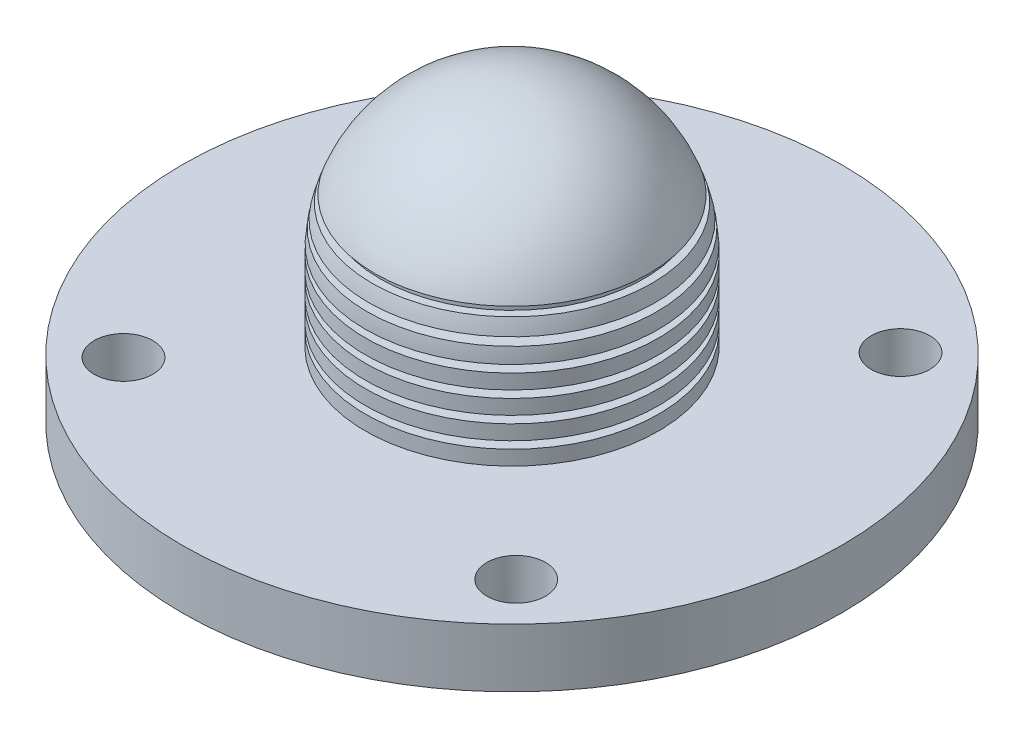
from build123d import *

# Parameters (mm, degrees)
SKETCH_1_R          = 22.5
EXTRUDE_1_DEPTH     = 4
SKETCH_2_R          = 10
EXTRUDE_2_DEPTH     = 16
FILLET_1_R          = 10
SKETCH_3_R          = 2
CUT_EXTRUDE_1_DEPTH = 10
SKETCH_4_W          = 1
SKETCH_4_H          = 0.5


with BuildPart() as part:
    # 草图1 → 凸台-拉伸1 (new body)
    with BuildSketch(Plane(origin=(0, 0, 0), x_dir=(1, 0, 0), z_dir=(0, 1, 0))):
        Circle(SKETCH_1_R)
    extrude(amount=EXTRUDE_1_DEPTH)

    # 草图2 → 凸台-拉伸2 (add)
    with BuildSketch(Plane(origin=(0, 4, 0), x_dir=(1, 0, 0), z_dir=(0, 1, 0))):
        Circle(SKETCH_2_R)
    extrude(amount=EXTRUDE_2_DEPTH)

    # 圆角1
    fillet_1_edges = [part.edges().sort_by_distance(p)[0] for p in [
        (-10, 20, 0),
    ]]
    fillet(fillet_1_edges, radius=FILLET_1_R)

    # 草图3 → 切除-拉伸1 (cut)
    with BuildSketch(Plane.XZ):
        with Locations((-13.113453203, 13.401486674)):
            Circle(SKETCH_3_R)
        with Locations((-13.401486674, -13.113453203)):
            Circle(SKETCH_3_R)
        with Locations((13.113453203, -13.401486674)):
            Circle(SKETCH_3_R)
        with Locations((13.401486674, 13.113453203)):
            Circle(SKETCH_3_R)
    extrude(amount=-CUT_EXTRUDE_1_DEPTH, mode=Mode.SUBTRACT)

    # 草图4 → 切除-旋转1 (revolve, cut)
    with BuildSketch(Plane.XY):
        with Locations((-9.5, 4.25)):
            Rectangle(SKETCH_4_W, SKETCH_4_H)
        with Locations((-9.5, 5.75)):
            Rectangle(SKETCH_4_W, SKETCH_4_H)
        with Locations((-9.5, 7.25)):
            Rectangle(SKETCH_4_W, SKETCH_4_H)
        with Locations((-9.5, 8.75)):
            Rectangle(SKETCH_4_W, SKETCH_4_H)
        with Locations((-9.5, 10.25)):
            Rectangle(SKETCH_4_W, SKETCH_4_H)
        with Locations((-9.5, 11.75)):
            Rectangle(SKETCH_4_W, SKETCH_4_H)
        with Locations((-9.5, 13.25)):
            Rectangle(SKETCH_4_W, SKETCH_4_H)
        with Locations((-9.5, 14.75)):
            Rectangle(SKETCH_4_W, SKETCH_4_H)
        with Locations((-9.5, 16.25)):
            Rectangle(SKETCH_4_W, SKETCH_4_H)
        with Locations((-9.5, 17.75)):
            Rectangle(SKETCH_4_W, SKETCH_4_H)
        with Locations((-9.5, 19.25)):
            Rectangle(SKETCH_4_W, SKETCH_4_H)
    revolve(axis=Axis((0, 0, 0), (0, 1, 0)), mode=Mode.SUBTRACT)


solid = part.part
